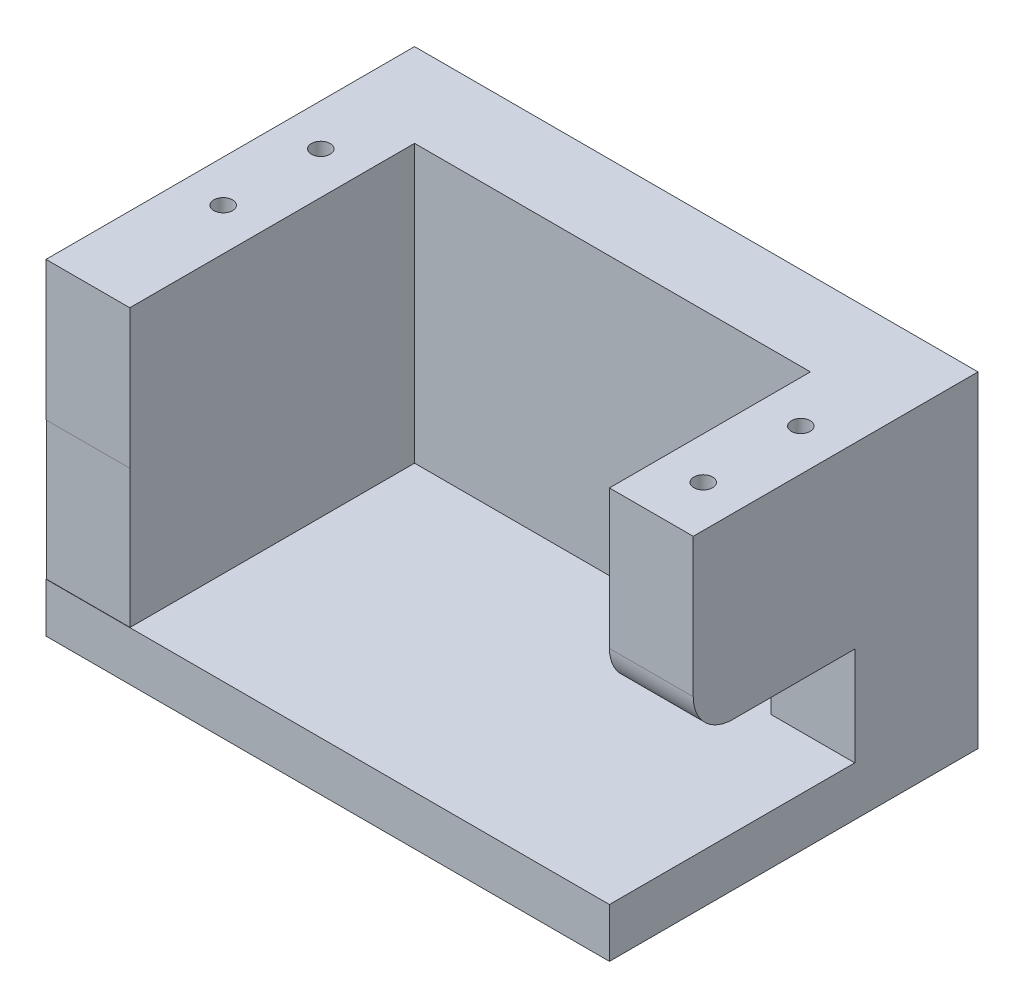
from build123d import *

# Parameters (mm, degrees)
SKETCH1_W           = 57.16
SKETCH1_H           = 37.39
SKETCH1_W_2         = 40.16
SKETCH1_H_2         = 20.39
BOSS_EXTRUDE1_DEPTH = 5
SKETCH2_W           = 57.16
SKETCH2_H           = 37.39
SKETCH2_W_2         = 40.16
SKETCH2_H_2         = 20.39
BOSS_EXTRUDE2_DEPTH = 28.1
SKETCH3_W           = 48.66
SKETCH3_H           = 8.5
CUT_EXTRUDE1_DEPTH  = 28.1
CUT_EXTRUDE2_REACH  = 63.749
SKETCH5_W           = 16.39
SKETCH5_H           = 10
FILLET1_R           = 4
SKETCH6_R           = 0.95
CUT_EXTRUDE3_DEPTH  = 12
CUT_EXTRUDE4_REACH  = 63.749
SKETCH8_W           = 8.5
SKETCH8_H           = 8.5
BOSS_EXTRUDE3_DEPTH = 14.1
BOSS_EXTRUDE4_REACH = 46.226
SKETCH9_W           = 8.5
SKETCH9_H           = 24.86117923


with BuildPart() as part:
    # Sketch1 → Boss-Extrude1 (new body)
    # profile 1 of 2: a face of its own
    with BuildSketch(Plane(origin=(0, 0, 0), x_dir=(1, 0, 0), z_dir=(0, 1, 0))):
        Rectangle(SKETCH1_W, SKETCH1_H)
        Rectangle(SKETCH1_W_2, SKETCH1_H_2, mode=Mode.SUBTRACT)
    # profile 2 of 2: a face of its own
    with BuildSketch(Plane(origin=(0, 0, 0), x_dir=(1, 0, 0), z_dir=(0, 1, 0))):
        Rectangle(SKETCH1_W_2, SKETCH1_H_2)
    extrude(amount=BOSS_EXTRUDE1_DEPTH)

    # Sketch2 → Boss-Extrude2 (add)
    with BuildSketch(Plane(origin=(0, 5, 0), x_dir=(1, 0, 0), z_dir=(0, 1, 0))):
        Rectangle(SKETCH2_W, SKETCH2_H)
        Rectangle(SKETCH2_W_2, SKETCH2_H_2, mode=Mode.SUBTRACT)
    extrude(amount=BOSS_EXTRUDE2_DEPTH)

    # Sketch3 → Cut-Extrude1 (cut)
    with BuildSketch(Plane(origin=(0, 33.1, 0), x_dir=(1, 0, 0), z_dir=(0, 1, 0))):
        with Locations((-4.25, -14.445)):
            Rectangle(SKETCH3_W, SKETCH3_H)
    extrude(amount=-CUT_EXTRUDE1_DEPTH, mode=Mode.SUBTRACT)

    # Sketch5 → Cut-Extrude2 (cut, up to next)
    with BuildSketch(Plane(origin=(-20.08, 0, 0), x_dir=(0, 0, -1), z_dir=(1, 0, 0)), mode=Mode.PRIVATE) as cut_extrude2_sk1:
        with Locations((-2, 10)):
            Rectangle(SKETCH5_W, SKETCH5_H)
    cut_extrude2_tool1 = extrude(cut_extrude2_sk1.sketch, amount=-CUT_EXTRUDE2_REACH, mode=Mode.PRIVATE) & part.part
    add(cut_extrude2_tool1.solids().sort_by_distance((-20.08, 10, 2))[0], mode=Mode.SUBTRACT)

    # Fillet1
    fillet1_edges = [part.edges().sort_by_distance(p)[0] for p in [
        (-24.33, 15, 10.195),
    ]]
    fillet(fillet1_edges, radius=FILLET1_R)

    # Sketch6 → Cut-Extrude3 (cut)
    with BuildSketch(Plane(origin=(0, 33.1, 0), x_dir=(1, 0, 0), z_dir=(0, 1, 0))):
        with Locations(Location((-24.35, -4.95, 0), (0, 0, 270))):
            Circle(SKETCH6_R)
        with Locations(Location((-24.35, 4.95, 0), (0, 0, 90))):
            Circle(SKETCH6_R)
        with Locations(Location((24.35, 4.95, 0), (0, 0, 270))):
            Circle(SKETCH6_R)
        with Locations(Location((24.35, -4.95, 0), (0, 0, 90))):
            Circle(SKETCH6_R)
    extrude(amount=-CUT_EXTRUDE3_DEPTH, mode=Mode.SUBTRACT)

    # Sketch7 → Cut-Extrude4 (cut, up to next)
    with BuildSketch(Plane.ZY.offset(-20.08), mode=Mode.PRIVATE) as cut_extrude4_sk1:
        with BuildLine():
            Line((10.195, 33.1), (10.195, 19))
            ThreePointArc((10.195, 19), (9.023427125, 16.171572875), (6.195, 15))
            Line((6.195, 15), (-6.195, 15))
            Line((-6.195, 15), (-6.195, 5))
            Line((-6.195, 5), (18.695, 5))
            Line((18.695, 5), (18.695, 33.1))
            Line((18.695, 33.1), (10.195, 33.1))
        make_face()
    cut_extrude4_tool1 = extrude(cut_extrude4_sk1.sketch, amount=-CUT_EXTRUDE4_REACH, mode=Mode.PRIVATE) & part.part
    add(cut_extrude4_tool1.solids().sort_by_distance((20.08, 15.371532, 9.379812))[0], mode=Mode.SUBTRACT)

    # Sketch8 → Boss-Extrude3 (add)
    with BuildSketch(Plane(origin=(0, 33.1, 0), x_dir=(1, 0, 0), z_dir=(0, 1, 0))):
        with Locations((-24.33, -14.445)):
            Rectangle(SKETCH8_W, SKETCH8_H)
    extrude(amount=-BOSS_EXTRUDE3_DEPTH)

    # Sketch9 → Boss-Extrude4 (add, up to next)
    with BuildSketch(Plane(origin=(0, 5, 0), x_dir=(1, 0, 0), z_dir=(0, 1, 0)), mode=Mode.PRIVATE) as boss_extrude4_sk1:
        with Locations((-24.33, -6.235589615)):
            Rectangle(SKETCH9_W, SKETCH9_H)
    boss_extrude4_tool1 = extrude(boss_extrude4_sk1.sketch, amount=BOSS_EXTRUDE4_REACH, mode=Mode.PRIVATE) - part.part
    add(boss_extrude4_tool1.solids().sort_by_distance((-24.33, 5, 6.23559))[0])


solid = part.part
